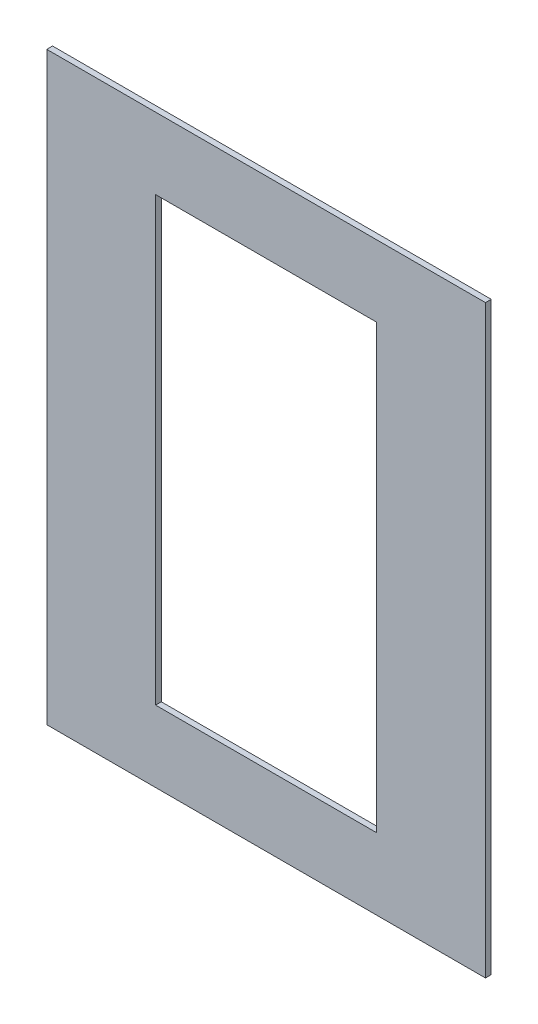
from build123d import *

# Parameters (mm, degrees)
SKETCH1_W           = 381
SKETCH1_H           = 508
BOSS_EXTRUDE1_DEPTH = 5
SKETCH2_W           = 192
SKETCH2_H           = 384
CUT_EXTRUDE1_DEPTH  = 636.019684734


with BuildPart() as part:
    # Sketch1 → Boss-Extrude1 (new body)
    with BuildSketch(Plane.XY):
        with Locations((190.5, 254)):
            Rectangle(SKETCH1_W, SKETCH1_H)
    extrude(amount=BOSS_EXTRUDE1_DEPTH)

    # Sketch2 → Cut-Extrude1 (cut, through all)
    with BuildSketch(Plane.XY.offset(5)):
        with Locations((190.5, 254)):
            Rectangle(SKETCH2_W, SKETCH2_H)
    extrude(amount=-CUT_EXTRUDE1_DEPTH, mode=Mode.SUBTRACT)


solid = part.part
